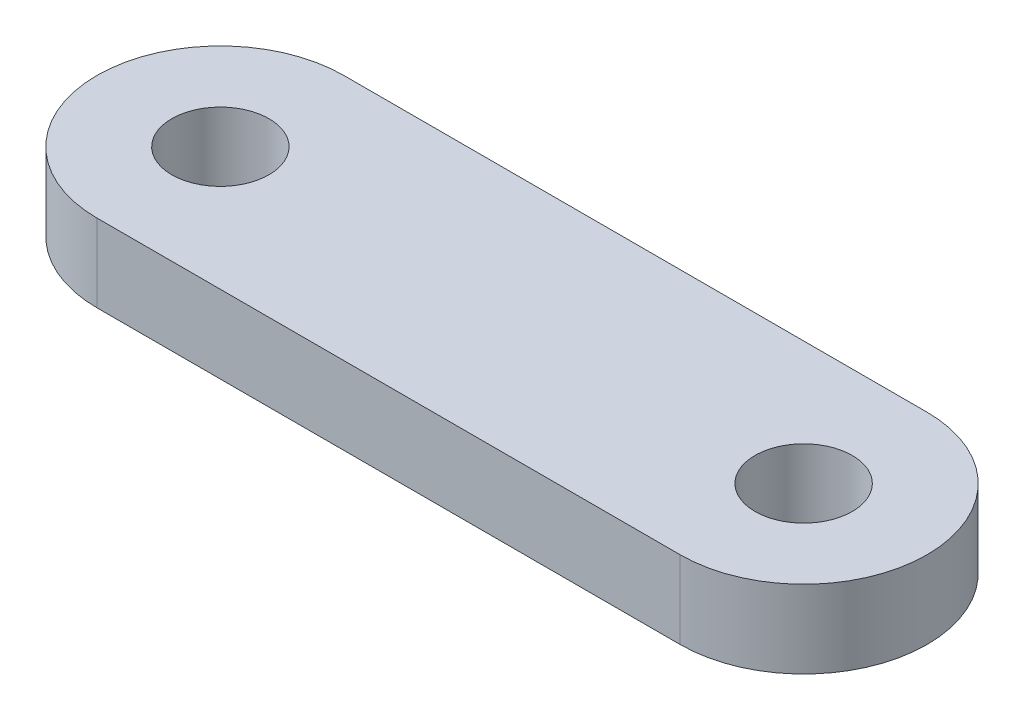
from build123d import *

# Parameters (mm, degrees)
ESBO_O1_R                = 5
RESSALTO_EXTRUS_O1_DEPTH = 4


with BuildPart() as part:
    # Esboço1 → Ressalto-extrusão1 (new, symmetric)
    with BuildSketch(Plane(origin=(0, 0, 0), x_dir=(1, 0, 0), z_dir=(0, 1, 0))):
        with BuildLine():
            Line((-30, 12.7), (30, 12.7))
            ThreePointArc((30, 12.7), (42.7, 0), (30, -12.7))
            Line((30, -12.7), (-30, -12.7))
            ThreePointArc((-30, -12.7), (-42.7, 0), (-30, 12.7))
        make_face()
        with Locations(Location((30, 0, 0), (0, 0, 270))):
            Circle(ESBO_O1_R, mode=Mode.SUBTRACT)
        with Locations(Location((-30, 0, 0), (0, 0, 270))):
            Circle(ESBO_O1_R, mode=Mode.SUBTRACT)
    extrude(amount=RESSALTO_EXTRUS_O1_DEPTH, both=True)


solid = part.part
